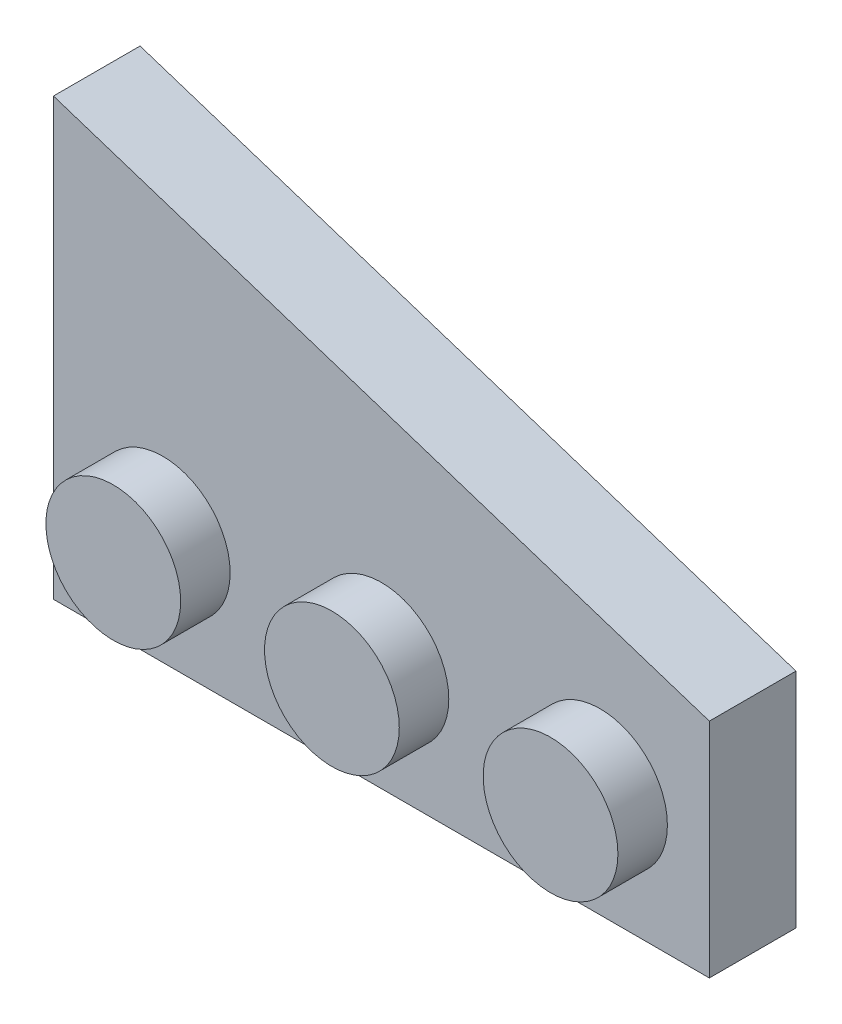
from build123d import *

# Parameters (mm, degrees)
BOSS_EXTRUDE1_DEPTH = 3.15
SKETCH2_R           = 2.45
BOSS_EXTRUDE2_DEPTH = 1.8
SHELL1_T            = -1.5


with BuildPart() as part:
    # Sketch1 → Boss-Extrude1 (new body)
    with BuildSketch(Plane.XY):
        Polygon((0, 0), (23.85, 0), (23.85, 8.09), (0, 15.85), align=None)
    extrude(amount=-BOSS_EXTRUDE1_DEPTH)

    # Sketch2 → Boss-Extrude2 (add)
    with BuildSketch(Plane.XY):
        with Locations((3.975, 4.045)):
            Circle(SKETCH2_R)
        with Locations((11.925, 4.045)):
            Circle(SKETCH2_R)
        with Locations((19.875, 4.045)):
            Circle(SKETCH2_R)
    extrude(amount=BOSS_EXTRUDE2_DEPTH)

    # Shell1
    shell1_openings = [part.faces().sort_by_distance(p)[0] for p in [
        (10.636528822, 6.194612921, -3.15),
    ]]
    offset(amount=SHELL1_T, openings=shell1_openings, kind=Kind.INTERSECTION)


solid = part.part
